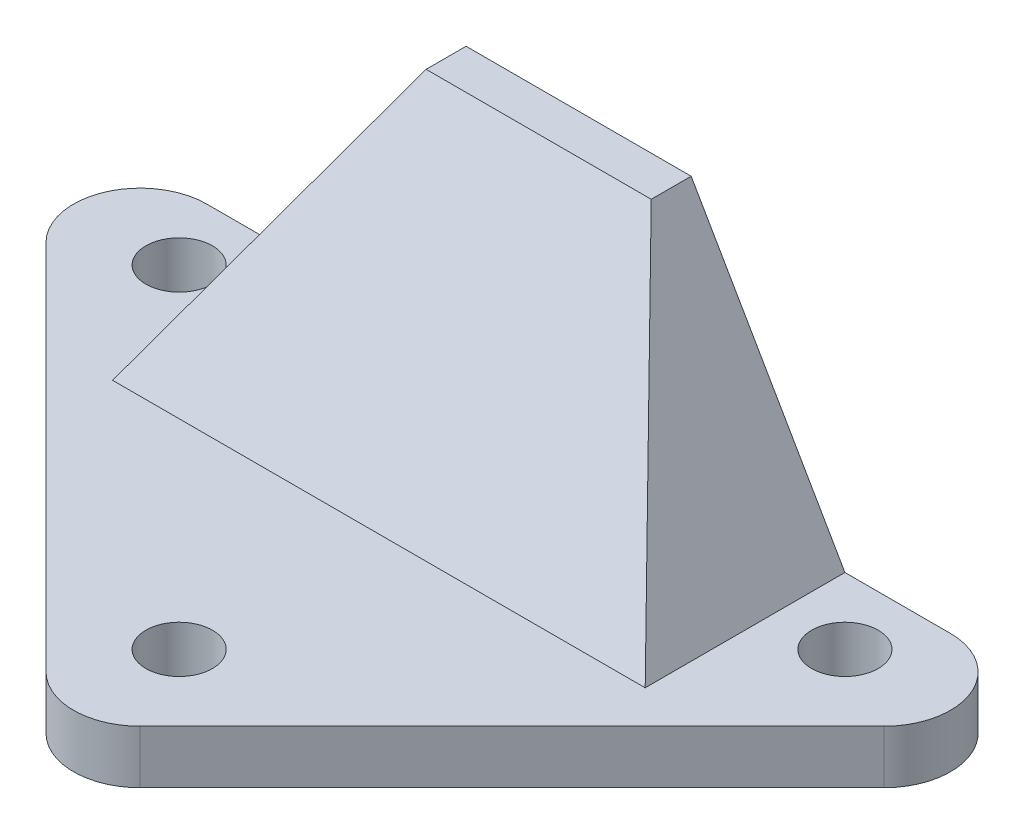
from build123d import *

# Parameters (mm, degrees)
SKETCH_1_R               = 2.5
EXTRUDE_1_DEPTH          = 4
EXTRUDE_2_DEPTH          = 15
SKETCH_3_W               = 28
SKETCH_3_H               = 4
CUT_EXTRUDE_1_DEPTH      = 8
CUT_EXTRUDE_2_DEPTH      = 60.149678768
CUT_EXTRUDE_2_DEPTH_BACK = 60.149678768


with BuildPart() as part:
    # 草图1 → 凸台-拉伸1 (new body)
    with BuildSketch(Plane(origin=(0, 0, 0), x_dir=(1, 0, 0), z_dir=(0, 1, 0))):
        with BuildLine():
            Line((-27.928932188, -4.947284101), (27.928932188, -4.947284101))
            ThreePointArc((27.928932188, -4.947284101), (32.548329851, -8.03386694), (31.464466094, -13.482818007))
            Line((31.464466094, -13.482818007), (3.535533906, -41.411750195))
            ThreePointArc((3.535533906, -41.411750195), (0, -42.87621629), (-3.535533906, -41.411750195))
            Line((-3.535533906, -41.411750195), (-31.464466094, -13.482818007))
            ThreePointArc((-31.464466094, -13.482818007), (-32.548329851, -8.03386694), (-27.928932188, -4.947284101))
        make_face()
        with Locations(Location((-25, -9.947284101, 0), (0, 0, 270))):
            Circle(SKETCH_1_R, mode=Mode.SUBTRACT)
        with Locations(Location((25, -9.947284101, 0), (0, 0, 270))):
            Circle(SKETCH_1_R, mode=Mode.SUBTRACT)
        with Locations(Location((0, -34.947284101, 0), (0, 0, 270))):
            Circle(SKETCH_1_R, mode=Mode.SUBTRACT)
    extrude(amount=EXTRUDE_1_DEPTH)

    # 草图2 → 凸台-拉伸2 (add)
    with BuildSketch(Plane(origin=(0, 0, 4.947284101), x_dir=(-1, 0, 0), z_dir=(0, 0, -1))):
        Polygon((-20, 4), (-8.452994616, 24), (8.452994616, 24), (20, 4), align=None)
    extrude(amount=-EXTRUDE_2_DEPTH)

    # 草图3 → 切除-拉伸1 (cut)
    with BuildSketch(Plane(origin=(0, 0, 4.947284101), x_dir=(-1, 0, 0), z_dir=(0, 0, -1))):
        with Locations((0, 2)):
            Rectangle(SKETCH_3_W, SKETCH_3_H)
    extrude(amount=-CUT_EXTRUDE_1_DEPTH, mode=Mode.SUBTRACT)

    # 草图4 → 切除-拉伸2 (cut, two sides: drawn at the far end of the back side and taken through both)
    with BuildSketch(Plane(origin=(0, 0, 0), x_dir=(0, 0, -1), z_dir=(1, 0, 0)).offset(-CUT_EXTRUDE_2_DEPTH_BACK)):
        Polygon((-19.947284101, 24), (-7.947284101, 24), (-19.947284101, 4), align=None)
    extrude(amount=CUT_EXTRUDE_2_DEPTH + CUT_EXTRUDE_2_DEPTH_BACK, mode=Mode.SUBTRACT)


solid = part.part
